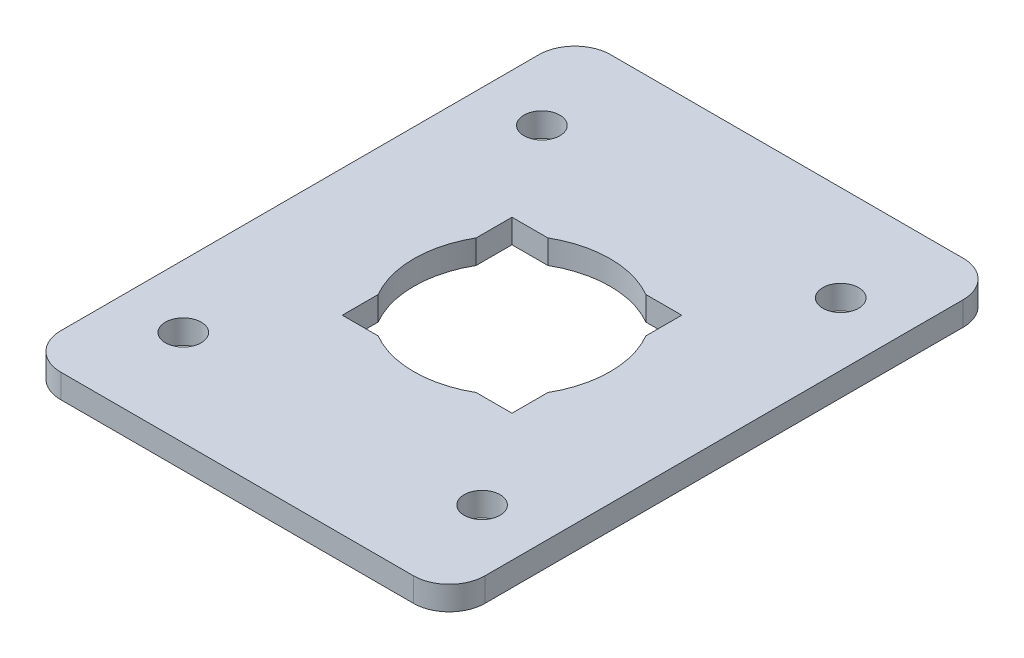
from build123d import *

# Parameters (mm, degrees)
SKETCH_1_W          = 35.5
SKETCH_1_H          = 46
EXTRUDE_1_DEPTH     = 2
FILLET_2_R          = 3
SKETCH_3_R          = 1.5
CUT_EXTRUDE_1_DEPTH = 10


with BuildPart() as part:
    # 草图1 → 凸台-拉伸1 (new body)
    with BuildSketch(Plane(origin=(0, 0, 0), x_dir=(1, 0, 0), z_dir=(0, 1, 0))):
        with Locations((0.862287952, 7.25)):
            Rectangle(SKETCH_1_W, SKETCH_1_H)
        with BuildLine():
            Line((-6.237712048, 3.147561701), (-6.237712048, 0.15))
            Line((-6.237712048, 0.15), (-3.240150347, 0.15))
            ThreePointArc((-3.240150347, 0.15), (0.862287952, -0.95), (4.964726252, 0.15))
            Line((4.964726252, 0.15), (7.962287952, 0.15))
            Line((7.962287952, 0.15), (7.962287952, 3.147561701))
            ThreePointArc((7.962287952, 3.147561701), (9.062287952, 7.25), (7.962287952, 11.352438299))
            Line((7.962287952, 11.352438299), (7.962287952, 14.35))
            Line((7.962287952, 14.35), (4.964726252, 14.35))
            ThreePointArc((4.964726252, 14.35), (0.862287952, 15.45), (-3.240150347, 14.35))
            Line((-3.240150347, 14.35), (-6.237712048, 14.35))
            Line((-6.237712048, 14.35), (-6.237712048, 11.352438299))
            ThreePointArc((-6.237712048, 11.352438299), (-7.337712048, 7.25), (-6.237712048, 3.147561701))
        make_face(mode=Mode.SUBTRACT)
    extrude(amount=EXTRUDE_1_DEPTH)

    # 圆角2
    fillet_2_edges = [part.edges().sort_by_distance(p)[0] for p in [
        (-16.887712048, 1, -30.25),
        (18.612287952, 1, -30.25),
        (18.612287952, 1, 15.75),
        (-16.887712048, 1, 15.75),
    ]]
    fillet(fillet_2_edges, radius=FILLET_2_R)

    # 草图3 → 切除-拉伸1 (cut)
    with BuildSketch(Plane.XZ):
        with Locations(Location((-11.637712048, 7.75, 0), (0, 0, 270))):
            Circle(SKETCH_3_R)
        with Locations(Location((-11.637712048, -22.25, 0), (0, 0, 270))):
            Circle(SKETCH_3_R)
        with Locations(Location((13.362287952, -22.25, 0), (0, 0, 270))):
            Circle(SKETCH_3_R)
        with Locations(Location((13.362287952, 7.75, 0), (0, 0, 270))):
            Circle(SKETCH_3_R)
    extrude(amount=-CUT_EXTRUDE_1_DEPTH, mode=Mode.SUBTRACT)


solid = part.part
